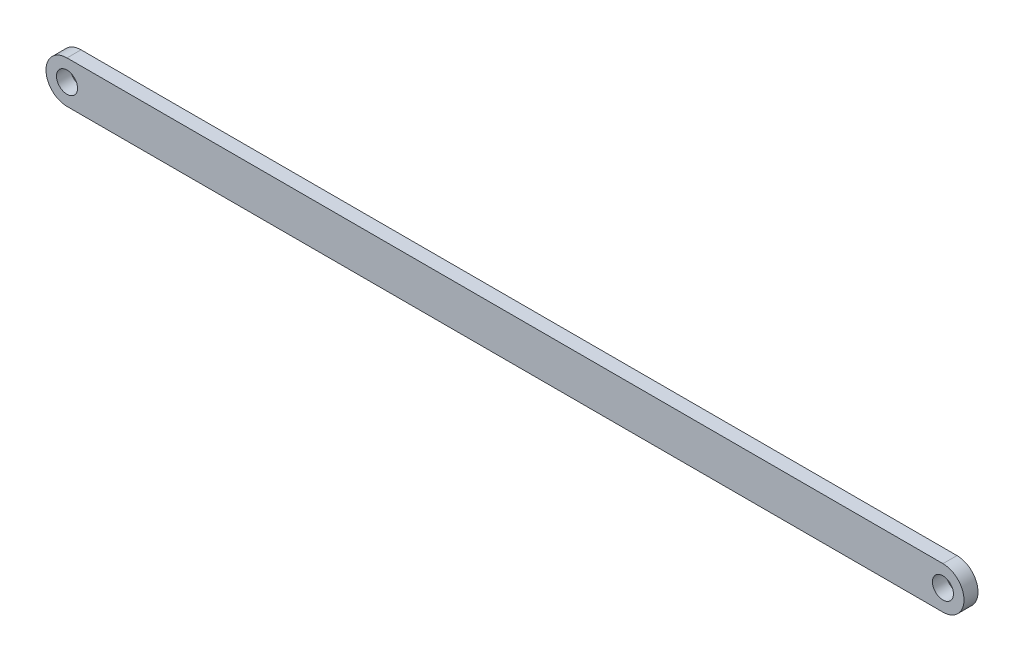
from build123d import *

# Parameters (mm, degrees)
SKETCH_1_R      = 3
EXTRUDE_1_DEPTH = 4


with BuildPart() as part:
    # ｽｹｯﾁ1 → ﾎﾞｽ - 押し出し1 (new body)
    with BuildSketch(Plane.XY):
        with BuildLine():
            Line((0, 6), (250, 6))
            ThreePointArc((250, 6), (256, 0), (250, -6))
            Line((250, -6), (0, -6))
            ThreePointArc((0, -6), (-6, 0), (0, 6))
        make_face()
        Circle(SKETCH_1_R, mode=Mode.SUBTRACT)
        with Locations((250, 0)):
            Circle(SKETCH_1_R, mode=Mode.SUBTRACT)
    extrude(amount=EXTRUDE_1_DEPTH)


solid = part.part
